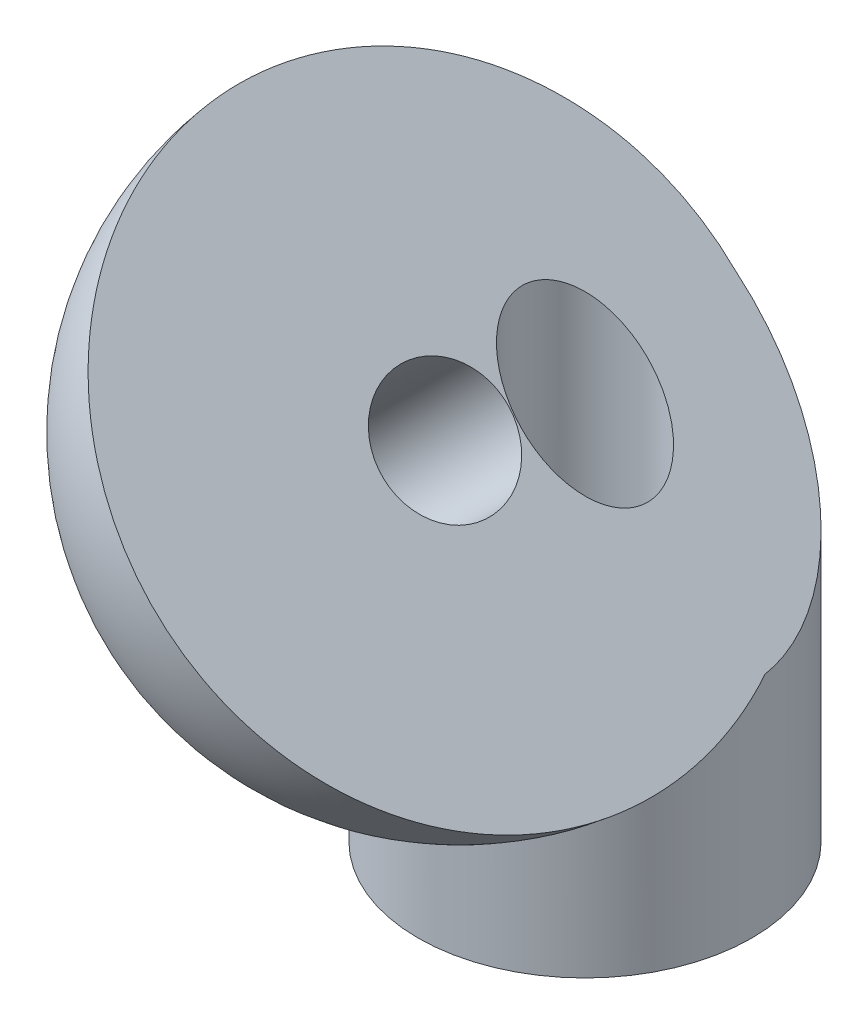
from build123d import *

# Parameters (mm, degrees)
SKETCH1_R               = 4
BOSS_EXTRUDE1_DEPTH     = 10
CUT_EXTRUDE1_DEPTH      = 21.928449536
CUT_EXTRUDE1_DEPTH_BACK = 21.928449536
SKETCH9_R               = 1.5
CUT_EXTRUDE5_DEPTH      = 19.276446179
SKETCH7_R               = 1.5
CUT_EXTRUDE3_DEPTH      = 20.008489752


with BuildPart() as part:
    # Sketch1 → Boss-Extrude1 (new body)
    with BuildSketch(Plane(origin=(0, 0, 0), x_dir=(1, 0, 0), z_dir=(0, 1, 0))):
        with Locations(Location((0, 0, 0), (0, 0, 270))):
            Circle(SKETCH1_R)
    extrude(amount=BOSS_EXTRUDE1_DEPTH)

    # Sketch2 → Revolve2 (revolve)
    with BuildSketch(Plane(origin=(0, 0, 0), x_dir=(0, 0, -1), z_dir=(1, 0, 0))):
        with BuildLine():
            Line((-3, 3), (-3, 17))
            ThreePointArc((-3, 17), (4, 10), (-3, 3))
        make_face()
    revolve(axis=Axis((0, 3, 3), (0, 1, 0)))

    # Sketch5 → Cut-Extrude1 (cut, two sides: drawn at the far end of the back side and taken through both)
    with BuildSketch(Plane.XY.offset(-CUT_EXTRUDE1_DEPTH_BACK)):
        Polygon((-7, 17), (7, 17), (7, 3), (6.646446609, 2.646446609), (-7.353553391, 16.646446609), align=None)
    extrude(amount=CUT_EXTRUDE1_DEPTH + CUT_EXTRUDE1_DEPTH_BACK, mode=Mode.SUBTRACT)

    # Sketch9 → Cut-Extrude5 (cut, through all)
    with BuildSketch(Plane(origin=(4.646446609, 4.646446609, 0), x_dir=(0, 0, -1), z_dir=(0.7071067811865462, 0.7071067811865489, 0))):
        with Locations(Location((-3, 7.071067812, 0), (0, 0, 90))):
            Circle(SKETCH9_R)
    extrude(amount=-CUT_EXTRUDE5_DEPTH, mode=Mode.SUBTRACT)

    # Sketch7 → Cut-Extrude3 (cut, through all)
    with BuildSketch(Plane.XZ):
        with Locations(Location((0, 0, 0), (0, 0, 270))):
            Circle(SKETCH7_R)
    extrude(amount=-CUT_EXTRUDE3_DEPTH, mode=Mode.SUBTRACT)


solid = part.part
